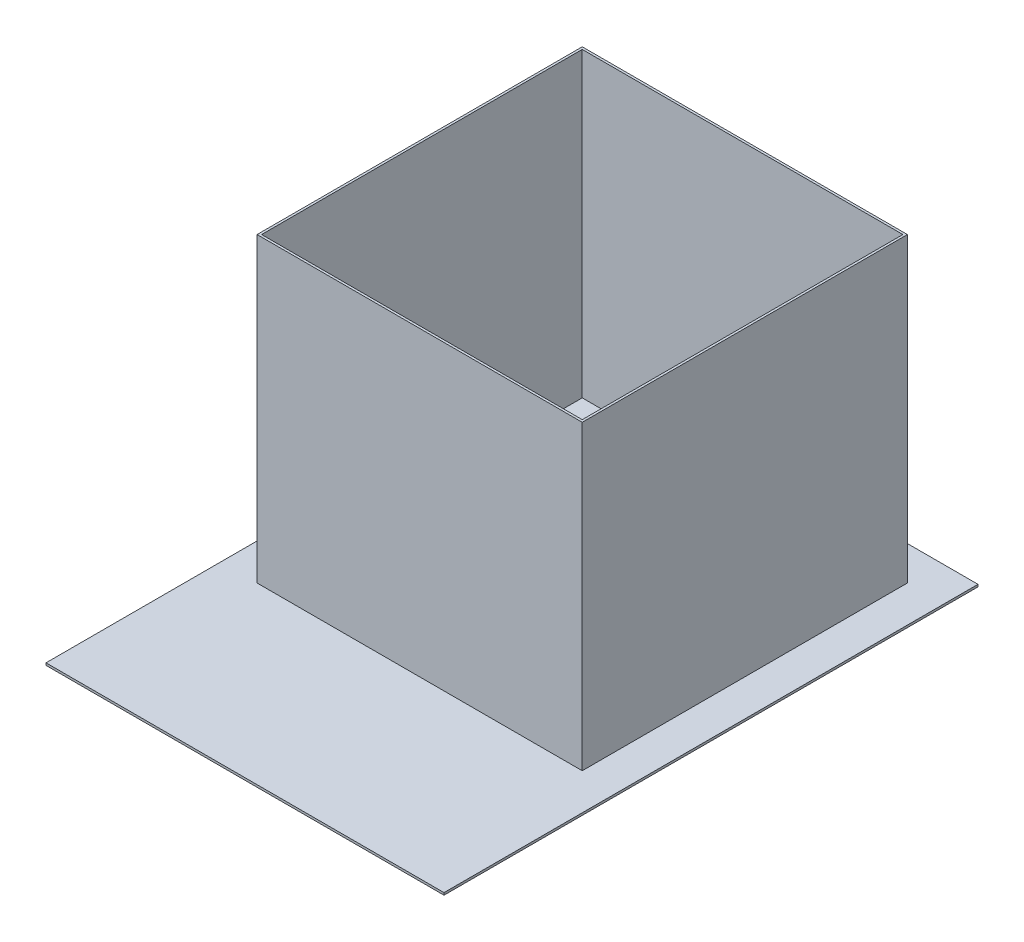
from build123d import *

# Parameters (mm, degrees)
CROQUIS1_W              = 86.2
CROQUIS1_H              = 86.2
CROQUIS1_W_2            = 85
CROQUIS1_H_2            = 85
SALIENTE_EXTRUIR1_DEPTH = 80
CROQUIS2_W              = 105.507174212
CROQUIS2_H              = 141.551480334
SALIENTE_EXTRUIR2_DEPTH = 0.6


with BuildPart() as part:
    # Croquis1 → Saliente-Extruir1 (new body)
    with BuildSketch(Plane(origin=(0, 0, 0), x_dir=(1, 0, 0), z_dir=(0, 1, 0))):
        with Locations((42.5, 42.5)):
            Rectangle(CROQUIS1_W, CROQUIS1_H)
        with Locations((42.5, 42.5)):
            Rectangle(CROQUIS1_W_2, CROQUIS1_H_2, mode=Mode.SUBTRACT)
    extrude(amount=SALIENTE_EXTRUIR1_DEPTH)

    # Croquis2 → Saliente-Extruir2 (add)
    with BuildSketch(Plane.XZ):
        with Locations((42.5, -23.881086904)):
            Rectangle(CROQUIS2_W, CROQUIS2_H)
    extrude(amount=SALIENTE_EXTRUIR2_DEPTH)


solid = part.part
